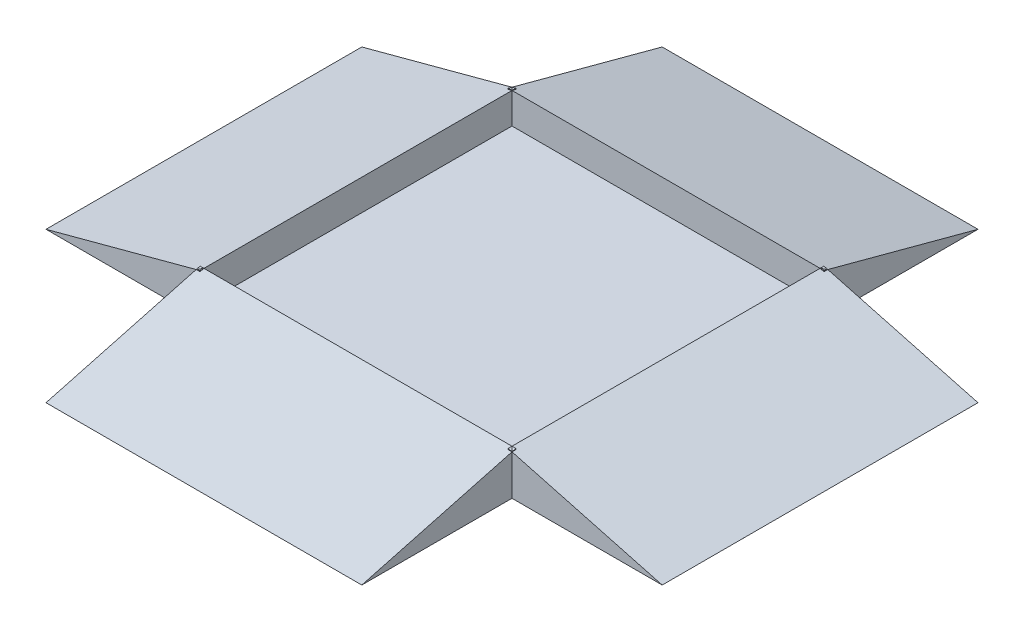
from build123d import *

# Parameters (mm, degrees)
BOSS_EXTRUDE1_DEPTH = 102.5
CIRPATTERN1_COUNT   = 4


with BuildPart() as part:
    # Sketch1 → Boss-Extrude1 (new, symmetric)
    with BuildSketch(Plane(origin=(0, 0, 0), x_dir=(0, 0, -1), z_dir=(1, 0, 0))):
        Polygon((0, 0), (0, 6.794919243), (-100, 6.794919243), (-100, 26.794919243), (-200, 0), align=None)
    boss_extrude1 = extrude(amount=BOSS_EXTRUDE1_DEPTH, both=True)

    # CirPattern1: Boss-Extrude1 ×4 about axis
    cirpattern1_axis = Axis((0, 28.134665205, 0), (0, -1, 0))
    for i in range(1, CIRPATTERN1_COUNT):
        add(boss_extrude1.rotate(cirpattern1_axis, i * 360 / CIRPATTERN1_COUNT))


solid = part.part
